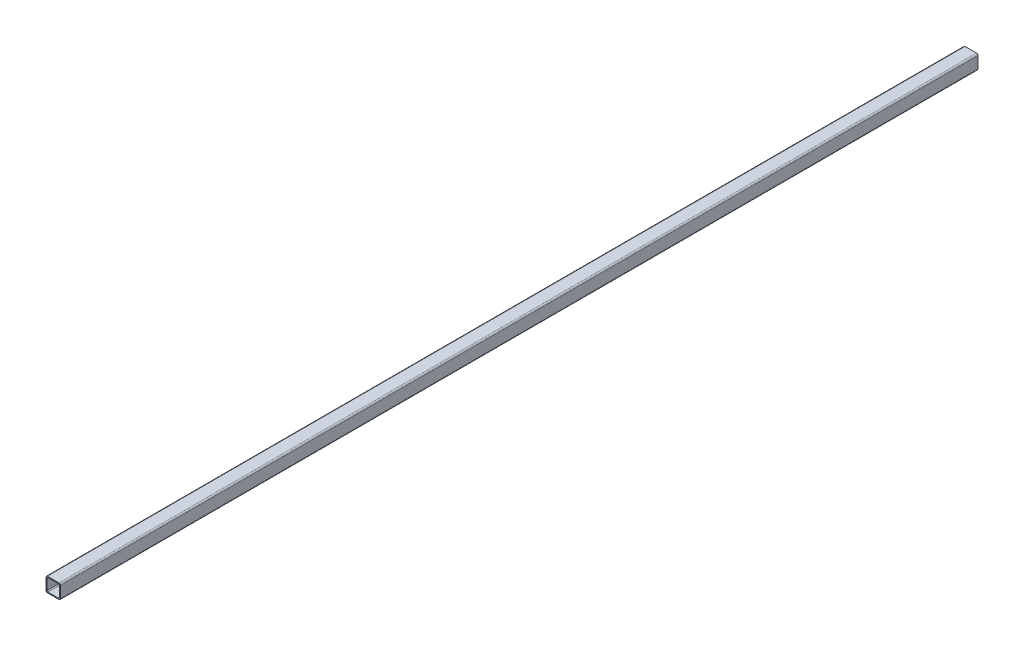
from build123d import *

# Parameters (mm, degrees)
EXTRUDE_1_DEPTH = 1910


with BuildPart() as part:
    # Эскиз1 → Бобышка-Вытянуть1 (new body)
    with BuildSketch(Plane.XY):
        with BuildLine():
            Line((-27, 30), (-3, 30))
            ThreePointArc((-3, 30), (-0.878679656, 29.121320344), (0, 27))
            Line((0, 27), (0, 3))
            ThreePointArc((0, 3), (-0.878679656, 0.878679656), (-3, 0))
            Line((-3, 0), (-27, 0))
            ThreePointArc((-27, 0), (-29.121320344, 0.878679656), (-30, 3))
            Line((-30, 3), (-30, 27))
            ThreePointArc((-30, 27), (-29.121320344, 29.121320344), (-27, 30))
        make_face()
        with BuildLine():
            Line((-26, 28), (-4, 28))
            ThreePointArc((-4, 28), (-2.585786438, 27.414213562), (-2, 26))
            Line((-2, 26), (-2, 4))
            ThreePointArc((-2, 4), (-2.585786438, 2.585786438), (-4, 2))
            Line((-4, 2), (-26, 2))
            ThreePointArc((-26, 2), (-27.414213562, 2.585786438), (-28, 4))
            Line((-28, 4), (-28, 26))
            ThreePointArc((-28, 26), (-27.414213562, 27.414213562), (-26, 28))
        make_face(mode=Mode.SUBTRACT)
    extrude(amount=-EXTRUDE_1_DEPTH)


solid = part.part
